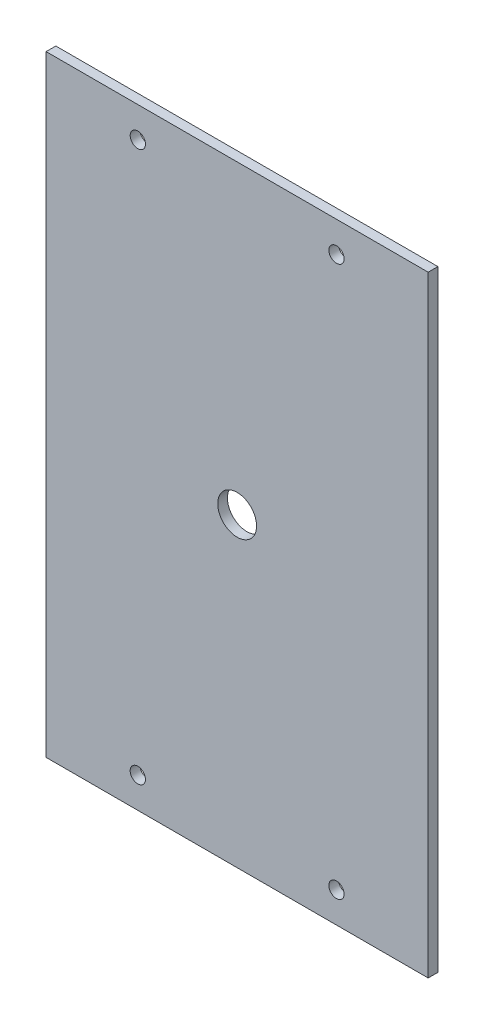
from build123d import *

# Parameters (mm, degrees)
SKETCH1_W           = 125
SKETCH1_H           = 200
BOSS_EXTRUDE1_DEPTH = 3.175
SKETCH2_R           = 2.5
CUT_EXTRUDE1_DEPTH  = 3.175
SKETCH3_R           = 6.35
CUT_EXTRUDE2_DEPTH  = 3.175


with BuildPart() as part:
    # Sketch1 → Boss-Extrude1 (new body)
    with BuildSketch(Plane.XY):
        with Locations((-62.5, 100)):
            Rectangle(SKETCH1_W, SKETCH1_H)
    extrude(amount=BOSS_EXTRUDE1_DEPTH)

    # Sketch2 → Cut-Extrude1 (cut)
    with BuildSketch(Plane.XY.offset(3.175)):
        with Locations((-95, 190)):
            Circle(SKETCH2_R)
        with Locations((-30, 190)):
            Circle(SKETCH2_R)
    cut_extrude1 = extrude(amount=-CUT_EXTRUDE1_DEPTH, mode=Mode.SUBTRACT)

    # Mirror1: Cut-Extrude1 across plane
    add(cut_extrude1.mirror(Plane.ZX.offset(100)), mode=Mode.SUBTRACT)

    # Sketch3 → Cut-Extrude2 (cut)
    with BuildSketch(Plane.XY.offset(3.175)):
        with Locations((-62.5, 100)):
            Circle(SKETCH3_R)
    extrude(amount=-CUT_EXTRUDE2_DEPTH, mode=Mode.SUBTRACT)


solid = part.part
